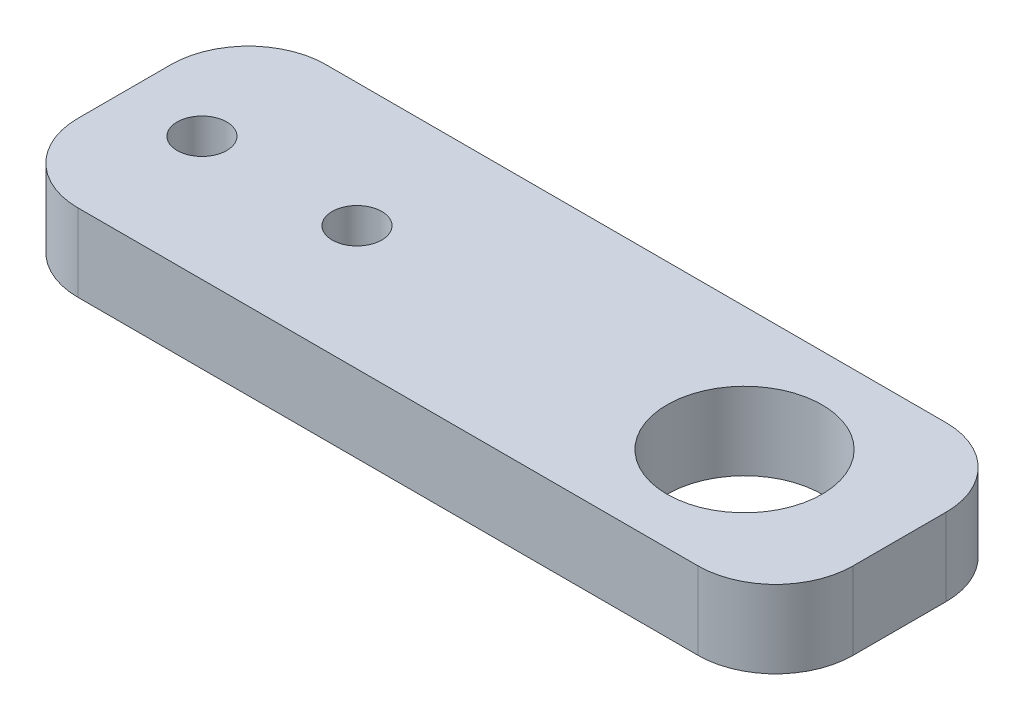
from build123d import *

# Parameters (mm, degrees)
SKETCH1_W           = 50
SKETCH1_H           = 16
SKETCH1_R           = 5
SKETCH1_R_2         = 1.6
BOSS_EXTRUDE1_DEPTH = 5
FILLET1_R           = 5


with BuildPart() as part:
    # Sketch1 → Boss-Extrude1 (new body)
    with BuildSketch(Plane(origin=(0, 0, 0), x_dir=(1, 0, 0), z_dir=(0, 1, 0))):
        with Locations((25, 8)):
            Rectangle(SKETCH1_W, SKETCH1_H)
        with Locations(Location((40, 8, 0), (0, 0, 270))):
            Circle(SKETCH1_R, mode=Mode.SUBTRACT)
        with Locations(Location((5, 8, 0), (0, 0, 270))):
            Circle(SKETCH1_R_2, mode=Mode.SUBTRACT)
        with Locations(Location((15, 8, 0), (0, 0, 270))):
            Circle(SKETCH1_R_2, mode=Mode.SUBTRACT)
    extrude(amount=BOSS_EXTRUDE1_DEPTH)

    # Fillet1
    fillet1_edges = [part.edges().sort_by_distance(p)[0] for p in [
        (0, 2.5, -16),
        (50, 2.5, -16),
        (50, 2.5, 0),
        (0, 2.5, 0),
    ]]
    fillet(fillet1_edges, radius=FILLET1_R)


solid = part.part
